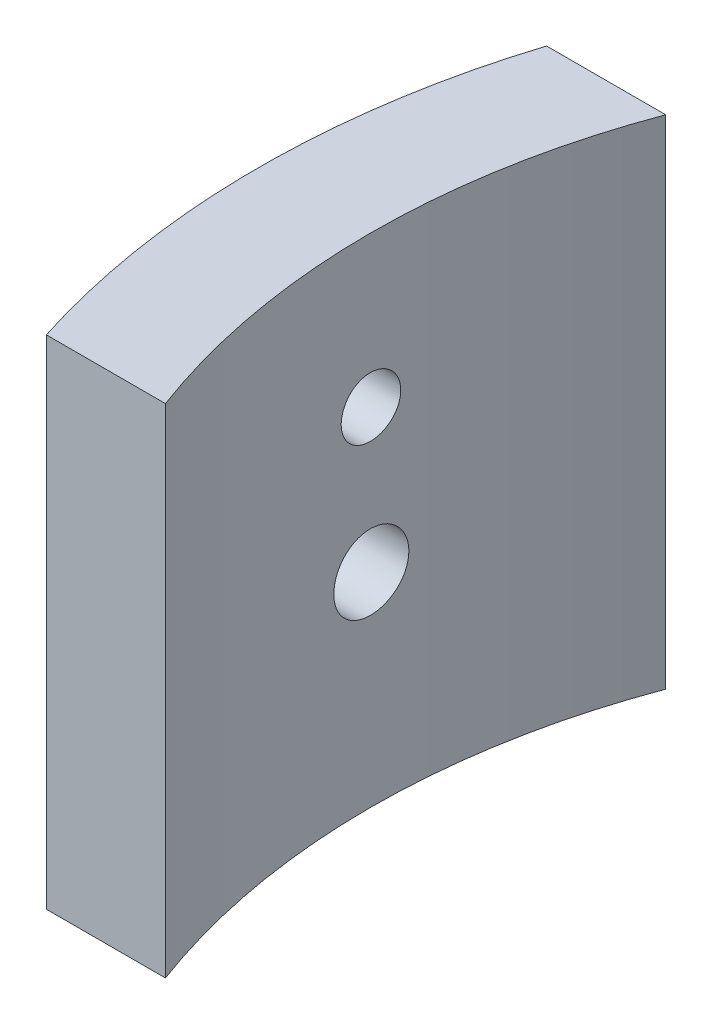
from build123d import *

# Parameters (mm, degrees)
BOSS_EXTRUDE1_DEPTH     = 38.1
SKETCH2_R               = 4.7625
SKETCH2_R_2             = 1.5875
BOSS_EXTRUDE3_DEPTH     = 2.409836439
CUT_EXTRUDE1_START      = -11.579198
CUT_EXTRUDE1_DEPTH      = 11.579198
SKETCH5_R               = 1.5875
CUT_EXTRUDE4_DEPTH      = 42.305774048
CUT_EXTRUDE5_REACH      = 43.306
CUT_EXTRUDE5_END_RADIUS = 44.104394081
SKETCH6_R               = 2


with BuildPart() as part:
    # Sketch1 → Boss-Extrude1 (new body)
    with BuildSketch(Plane(origin=(0, 0, 0), x_dir=(1, 0, 0), z_dir=(0, 1, 0))):
        with BuildLine():
            Line((-42.040163561, -13.335), (-35.690163561, -13.335))
            ThreePointArc((-35.690163561, -13.335), (-38.1, 0), (-35.690163561, 13.335))
            Line((-35.690163561, 13.335), (-42.040163561, 13.335))
            ThreePointArc((-42.040163561, 13.335), (-44.104394081, 0), (-42.040163561, -13.335))
        make_face()
    extrude(amount=BOSS_EXTRUDE1_DEPTH)

    # Sketch2 → Boss-Extrude3 (add)
    with BuildSketch(Plane.ZY.offset(42.040163561)):
        with Locations(Location((0, 30.070397704, 0), (0, 0, 180))):
            Circle(SKETCH2_R)
        with Locations(Location((0, 30.070397704, 0), (0, 0, 180))):
            Circle(SKETCH2_R_2, mode=Mode.SUBTRACT)
    extrude(amount=BOSS_EXTRUDE3_DEPTH)

    # Sketch3 → Cut-Extrude1 (cut)
    with BuildSketch(Plane.XZ.offset(CUT_EXTRUDE1_START)):
        with BuildLine():
            Line((-42.040163561, 13.335), (-35.690163561, 13.335))
            ThreePointArc((-35.690163561, 13.335), (-38.1, 0), (-35.690163561, -13.335))
            Line((-35.690163561, -13.335), (-42.040163561, -13.335))
            ThreePointArc((-42.040163561, -13.335), (-44.104394081, 0), (-42.040163561, 13.335))
        make_face()
    extrude(amount=CUT_EXTRUDE1_DEPTH, mode=Mode.SUBTRACT)

    # Sketch5 → Cut-Extrude4 (cut, through all)
    with BuildSketch(Plane.ZY.offset(44.45)):
        with Locations((0, 30.070397704)):
            Circle(SKETCH5_R)
    extrude(amount=-CUT_EXTRUDE4_DEPTH, mode=Mode.SUBTRACT)

    # Cut-Extrude5: up to this cylinder (the profile starts inside it)
    cut_extrude5_end = Plane(origin=(0, 22.450398, 0), z_dir=(0, -1, 0)) * Cylinder(CUT_EXTRUDE5_END_RADIUS, 175.820788161, mode=Mode.PRIVATE)
    # Sketch6 → Cut-Extrude5 (cut, up to the surface)
    with BuildSketch(Plane(origin=(-35.690163561, 0, 0), x_dir=(0, 0, -1), z_dir=(1, 0, 0)), mode=Mode.PRIVATE) as cut_extrude5_sk1:
        with Locations((0, 22.450397704)):
            Circle(SKETCH6_R)
    cut_extrude5_tool1 = extrude(cut_extrude5_sk1.sketch, amount=-CUT_EXTRUDE5_REACH, mode=Mode.PRIVATE) & cut_extrude5_end
    add(cut_extrude5_tool1.solids().sort_by_distance((-35.690164, 22.450398, 0))[0], mode=Mode.SUBTRACT)


solid = part.part
